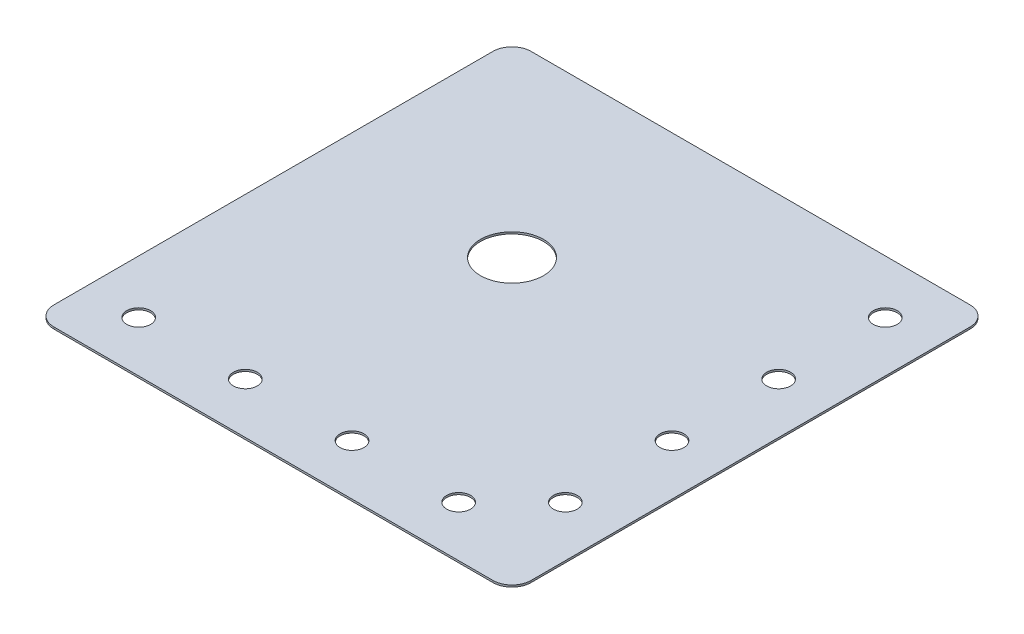
from build123d import *

# Parameters (mm, degrees)
SKETCH1_R           = 3.3
SKETCH1_R_2         = 1.25
BOSS_EXTRUDE1_DEPTH = 0.2


with BuildPart() as part:
    # Sketch1 → Boss-Extrude1 (new body)
    with BuildSketch(Plane(origin=(0, 0, 0), x_dir=(1, 0, 0), z_dir=(0, 1, 0))):
        with BuildLine():
            Line((-37.367243025, 42.925002652), (-37.367243025, -3.074997348))
            ThreePointArc((-37.367243025, -3.074997348), (-36.781456588, -4.48921091), (-35.367243025, -5.074997348))
            Line((-35.367243025, -5.074997348), (10.632756975, -5.074997348))
            ThreePointArc((10.632756975, -5.074997348), (12.046970537, -4.48921091), (12.632756975, -3.074997348))
            Line((12.632756975, -3.074997348), (12.632756975, 42.925002652))
            ThreePointArc((12.632756975, 42.925002652), (12.046970537, 44.339216214), (10.632756975, 44.925002652))
            Line((10.632756975, 44.925002652), (-35.367243025, 44.925002652))
            ThreePointArc((-35.367243025, 44.925002652), (-36.781456588, 44.339216214), (-37.367243025, 42.925002652))
        make_face()
        with Locations(Location((-17.667243025, 25.225002652, 0), (0, 0, 270))):
            Circle(SKETCH1_R, mode=Mode.SUBTRACT)
        with Locations(Location((7.332756975, 16.987502652, 0), (0, 0, 270))):
            Circle(SKETCH1_R_2, mode=Mode.SUBTRACT)
        with Locations(Location((7.332756975, 28.162502652, 0), (0, 0, 270))):
            Circle(SKETCH1_R_2, mode=Mode.SUBTRACT)
        with Locations(Location((7.332756975, 39.337502652, 0), (0, 0, 270))):
            Circle(SKETCH1_R_2, mode=Mode.SUBTRACT)
        with Locations(Location((7.332756975, 5.812502652, 0), (0, 0, 270))):
            Circle(SKETCH1_R_2, mode=Mode.SUBTRACT)
        with Locations(Location((1.745256975, 0.225002652, 0), (0, 0, 270))):
            Circle(SKETCH1_R_2, mode=Mode.SUBTRACT)
        with Locations(Location((-9.429743025, 0.225002652, 0), (0, 0, 270))):
            Circle(SKETCH1_R_2, mode=Mode.SUBTRACT)
        with Locations(Location((-20.604743025, 0.225002652, 0), (0, 0, 270))):
            Circle(SKETCH1_R_2, mode=Mode.SUBTRACT)
        with Locations(Location((-31.779743025, 0.225002652, 0), (0, 0, 270))):
            Circle(SKETCH1_R_2, mode=Mode.SUBTRACT)
    extrude(amount=BOSS_EXTRUDE1_DEPTH)


solid = part.part
